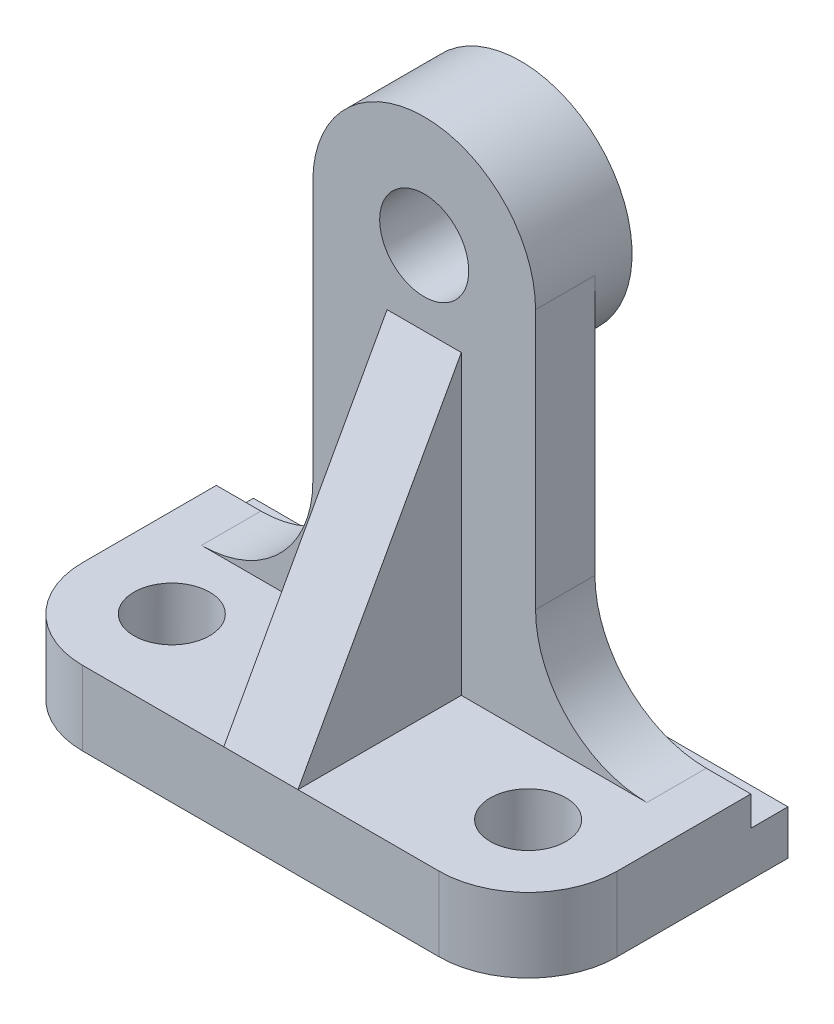
from build123d import *

# Parameters (mm, degrees)
BOSS_EXTRUDE1_DEPTH    = 10
SKETCH2_W              = 5
SKETCH2_H              = 4
CUT_EXTRUDE1_DEPTH     = 75.767974428
SKETCH3_R              = 6
BOSS_EXTRUDE3_DEPTH    = 8
BOSS_EXTRUDE4_START    = 5
SKETCH3_3_R            = 6
BOSS_EXTRUDE4_DEPTH    = 5
RIB1_REACH             = 87.013
SKETCH4_WALL_W         = 217.67731737
SKETCH4_WALL_H         = 10
M12_TAPPED_HOLE1_D     = 10.2
M12_TAPPED_HOLE1_DEPTH = 29.25


with BuildPart() as part:
    # Sketch1 → Boss-Extrude1 (new body)
    with BuildSketch(Plane(origin=(0, 0, 0), x_dir=(1, 0, 0), z_dir=(0, 1, 0))):
        with BuildLine():
            Line((-24, -17.5), (24, -17.5))
            ThreePointArc((24, -17.5), (32.485281374, -13.985281374), (36, -5.5))
            Line((36, -5.5), (36, 17.5))
            Line((36, 17.5), (-36, 17.5))
            Line((-36, 17.5), (-36, -5.5))
            ThreePointArc((-36, -5.5), (-32.485281374, -13.985281374), (-24, -17.5))
        make_face()
    extrude(amount=BOSS_EXTRUDE1_DEPTH)

    # Sketch2 → Cut-Extrude1 (cut, through all)
    with BuildSketch(Plane.ZY.offset(36)):
        with Locations((-15, 8)):
            Rectangle(SKETCH2_W, SKETCH2_H)
    extrude(amount=-CUT_EXTRUDE1_DEPTH, mode=Mode.SUBTRACT)

    # Sketch3 → Boss-Extrude3 (add)
    with BuildSketch(Plane(origin=(0, 0, -12.5), x_dir=(-1, 0, 0), z_dir=(0, 0, -1))):
        with BuildLine():
            Line((15, 25), (15, 60))
            ThreePointArc((15, 60), (0, 75), (-15, 60))
            Line((-15, 60), (-15, 25))
            ThreePointArc((-15, 25), (-19.393398282, 14.393398282), (-30, 10))
            Line((-30, 10), (-30, 9))
            Line((-30, 9), (30, 9))
            Line((30, 9), (30, 10))
            ThreePointArc((30, 10), (19.393398282, 14.393398282), (15, 25))
        make_face()
        with Locations((0, 60)):
            Circle(SKETCH3_R, mode=Mode.SUBTRACT)
    extrude(amount=-BOSS_EXTRUDE3_DEPTH)

    # Sketch3<3> → Boss-Extrude4 (add)
    with BuildSketch(Plane(origin=(0, 0, -12.5), x_dir=(-1, 0, 0), z_dir=(0, 0, -1)).offset(BOSS_EXTRUDE4_START)):
        with BuildLine():
            ThreePointArc((15, 60), (0, 75), (-15, 60))
            ThreePointArc((-15, 60), (0, 45), (15, 60))
        make_face()
        with Locations((0, 60)):
            Circle(SKETCH3_3_R, mode=Mode.SUBTRACT)
    extrude(amount=-BOSS_EXTRUDE4_DEPTH)

    # Sketch4 wall → Rib1 (add, up to next)
    with BuildSketch(Plane(origin=(0, 30, 6.5), x_dir=(0, 0.876215908677, -0.481918749772), z_dir=(0, 0.481918749772, 0.876215908677)), mode=Mode.PRIVATE) as rib1_sk1:
        Rectangle(SKETCH4_WALL_W, SKETCH4_WALL_H)
    rib1_tool1 = extrude(rib1_sk1.sketch, amount=-RIB1_REACH, mode=Mode.PRIVATE) - part.part
    add(rib1_tool1.solids().sort_by_distance((0, 30, 6.5))[0])

    # M12 Tapped Hole1
    with Locations(Plane(origin=(0, 10, 0), x_dir=(1, 0, 0), z_dir=(0, 1, 0))):
        with Locations((-24, -5.5), (24, -5.5)):
            Hole(M12_TAPPED_HOLE1_D / 2, depth=M12_TAPPED_HOLE1_DEPTH)


solid = part.part
